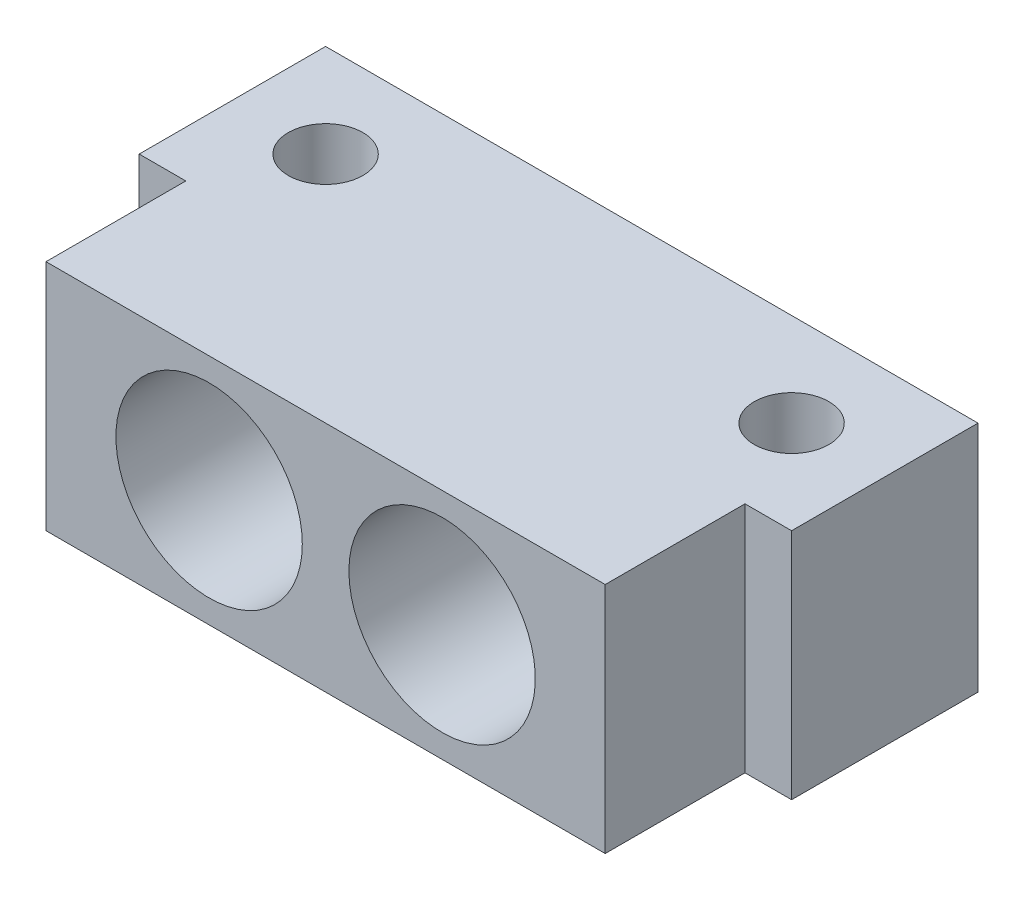
from build123d import *

# Parameters (mm, degrees)
SKETCH1_R           = 4
BOSS_EXTRUDE1_DEPTH = 25
SKETCH2_R           = 10
CUT_EXTRUDE1_DEPTH  = 15


with BuildPart() as part:
    # Sketch1 → Boss-Extrude1 (new body)
    with BuildSketch(Plane(origin=(0, 0, 0), x_dir=(1, 0, 0), z_dir=(0, 1, 0))):
        Polygon((-35, -10), (-30, -10), (-30, -25), (30, -25), (30, -10), (35, -10), (35, 10), (-35, 10), align=None)
        with Locations(Location((-25, 0, 0), (0, 0, 270))):
            Circle(SKETCH1_R, mode=Mode.SUBTRACT)
        with Locations(Location((25, 0, 0), (0, 0, 90))):
            Circle(SKETCH1_R, mode=Mode.SUBTRACT)
    extrude(amount=BOSS_EXTRUDE1_DEPTH)

    # Sketch2 → Cut-Extrude1 (cut)
    with BuildSketch(Plane.XY.offset(25)):
        with Locations((-12.5, 12.5)):
            Circle(SKETCH2_R)
        with Locations(Location((12.5, 12.5, 0), (0, 0, 180))):
            Circle(SKETCH2_R)
    extrude(amount=-CUT_EXTRUDE1_DEPTH, mode=Mode.SUBTRACT)


solid = part.part
